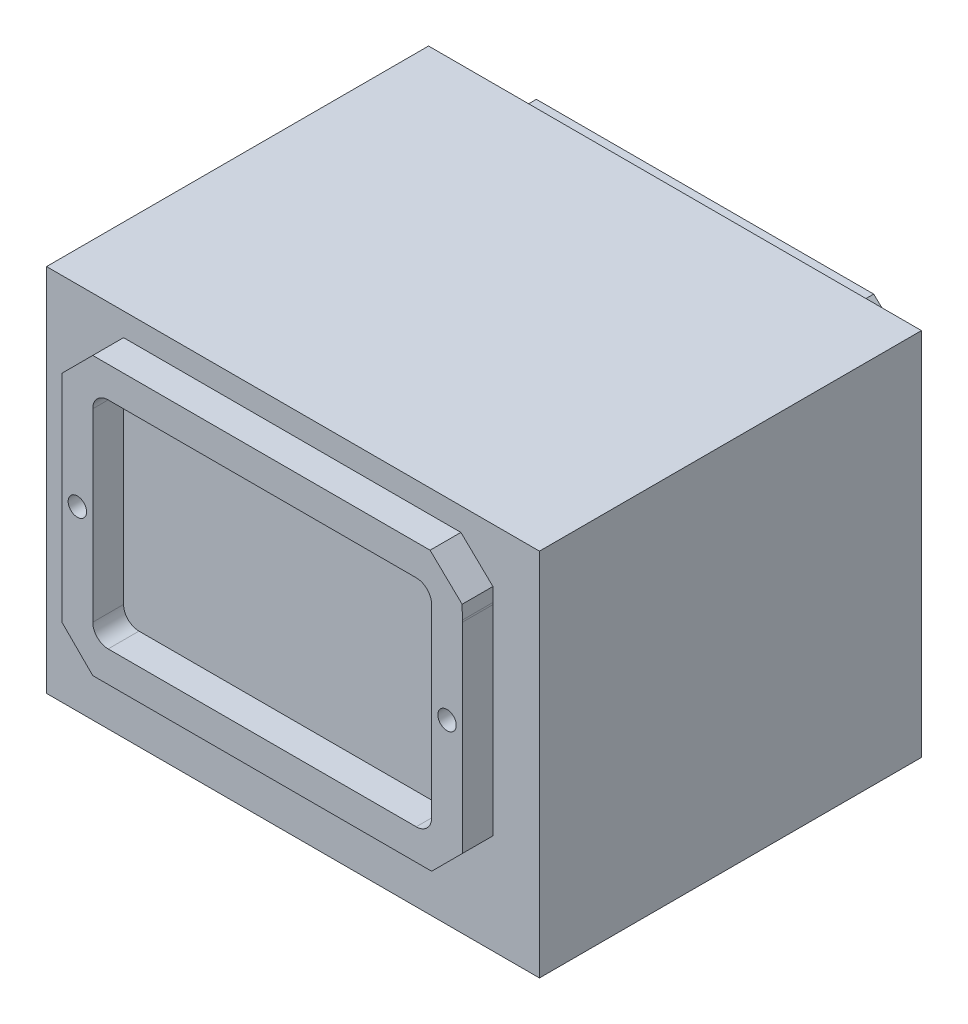
from build123d import *
from OCP.BRepFilletAPI import BRepFilletAPI_MakeChamfer

# Parameters (mm, degrees)
SKETCH1_W                        = 101.6
SKETCH1_H                        = 76.2
EXTRUDE1_DEPTH                   = 76.2
EXTRUDE2_DEPTH                   = 6.35
F_10_24_TAPPED_HOLE1_D           = 3.7973
F_10_24_TAPPED_HOLE1_DEPTH       = 12.954
F_10_24_TAPPED_HOLE1_TIP         = 1.140824014
EXTRUDE3_DEPTH                   = 6.35
CHAMFER1_SIZE                    = 6.35
CHAMFER1_SIZE2                   = 6.479869459
EXTRUDE4_DEPTH                   = 6.35
SKETCH8_W                        = 101.6
SKETCH8_H                        = 76.2
EXTRUDE5_DEPTH                   = 2.54
F_10_24_TAPPED_HOLE2_D           = 3.7973
F_10_24_TAPPED_HOLE2_DEPTH       = 12.954
F_10_24_TAPPED_HOLE2_CBORE_D     = 4.826
F_10_24_TAPPED_HOLE2_CBORE_DEPTH = 9.652
F_10_24_TAPPED_HOLE2_TIP         = 1.140824014


with BuildPart() as part:
    # Sketch1 → Extrude1 (new body)
    with BuildSketch(Plane(origin=(0, 0, 0), x_dir=(1, 0, 0), z_dir=(0, 1, 0))):
        with Locations((50.8, 38.1)):
            Rectangle(SKETCH1_W, SKETCH1_H)
    extrude(amount=-EXTRUDE1_DEPTH)

    # Sketch3 → Extrude2 (add)
    with BuildSketch(Plane.XY):
        with BuildLine():
            Line((19.05, -4.754440133), (82.55, -4.754440133))
            ThreePointArc((82.55, -4.754440133), (89.285192091, -7.544248042), (92.075, -14.279440133))
            Line((92.075, -14.279440133), (92.075, -52.379440133))
            ThreePointArc((92.075, -52.379440133), (89.285192091, -59.114632223), (82.55, -61.904440133))
            Line((82.55, -61.904440133), (19.05, -61.904440133))
            ThreePointArc((19.05, -61.904440133), (12.314807909, -59.114632223), (9.525, -52.379440133))
            Line((9.525, -52.379440133), (9.525, -14.279440133))
            ThreePointArc((9.525, -14.279440133), (12.314807909, -7.544248042), (19.05, -4.754440133))
        make_face()
        with BuildLine():
            Line((19.05, -11.104440133), (82.55, -11.104440133))
            ThreePointArc((82.55, -11.104440133), (84.79506403, -12.034376102), (85.725, -14.279440133))
            Line((85.725, -14.279440133), (85.725, -52.379440133))
            ThreePointArc((85.725, -52.379440133), (84.79506403, -54.624504163), (82.55, -55.554440133))
            Line((82.55, -55.554440133), (19.05, -55.554440133))
            ThreePointArc((19.05, -55.554440133), (16.80493597, -54.624504163), (15.875, -52.379440133))
            Line((15.875, -52.379440133), (15.875, -14.279440133))
            ThreePointArc((15.875, -14.279440133), (16.80493597, -12.034376102), (19.05, -11.104440133))
        make_face(mode=Mode.SUBTRACT)
    extrude(amount=EXTRUDE2_DEPTH)

    # #10-24 Tapped Hole1
    with Locations(Plane(origin=(12.7, -33.329440133, 6.35), x_dir=(1, 0, 0), z_dir=(0, 0, 1))):
        with Locations((0, 0), (76.2, 0)):
            Hole(F_10_24_TAPPED_HOLE1_D / 2, depth=F_10_24_TAPPED_HOLE1_DEPTH)
            with Locations((0, 0, -(F_10_24_TAPPED_HOLE1_DEPTH + F_10_24_TAPPED_HOLE1_TIP / 2))):  # 118° drill point
                Cone(0, F_10_24_TAPPED_HOLE1_D / 2, F_10_24_TAPPED_HOLE1_TIP, mode=Mode.SUBTRACT)

    # Sketch6 → Extrude3 (add)
    with BuildSketch(Plane.XY):
        Polygon((82.55, -4.754440133), (91.885938624, -4.754440133), (92.075, -14.279440133), align=None)
        Polygon((92.075, -52.379440133), (82.55, -61.904440133), (92.075, -61.904440133), align=None)
        Polygon((9.525, -14.279440133), (19.05, -4.754440133), (9.525, -4.754440133), align=None)
        Polygon((9.525, -52.379440133), (19.05, -61.904440133), (9.525, -61.904440133), align=None)
    extrude(amount=EXTRUDE3_DEPTH)

    # Chamfer1: one chamfer whose edges measure the first distance from different faces: ONE call of the kernel's chamfer builder (chamfer() names one face for all edges)
    chamfer1_edges_1 = [part.edges().sort_by_distance(p)[0] for p in [
        (92.075, -61.904440133, 3.175),
        (9.525, -61.904440133, 3.175),
        (9.525, -4.754440133, 3.175),
    ]]
    chamfer1_edges_2 = [part.edges().sort_by_distance(p)[0] for p in [
        (91.885938624, -4.754440133, 3.175),
    ]]
    chamfer1_side_2 = [part.faces().sort_by_distance(p)[0] for p in [
        (91.976718118, -9.327953214, 3.175),
    ]]
    chamfer1 = BRepFilletAPI_MakeChamfer(part.part.solid().wrapped)
    for e in chamfer1_edges_1:
        chamfer1.Add(CHAMFER1_SIZE, e.wrapped)
    for e in chamfer1_edges_2:
        chamfer1.Add(CHAMFER1_SIZE, CHAMFER1_SIZE2, e.wrapped, chamfer1_side_2[0].wrapped)  # the first distance lies on this face
    add(Compound.cast(chamfer1.Shape()), mode=Mode.REPLACE)



with BuildPart() as body_2:
    # Sketch7 → Extrude4 (new body)
    with BuildSketch(Plane(origin=(0, 0, -78.74), x_dir=(-1, 0, 0), z_dir=(0, 0, -1))):
        Polygon((-85.406069165, -4.754440133), (-15.875, -4.754440133), (-9.525, -11.104440133), (-9.525, -55.554440133), (-15.875, -61.904440133), (-85.725, -61.904440133), (-92.075, -55.554440133), (-92.075, -11.103141464), align=None)
        with BuildLine():
            Line((-15.875, -14.406440133), (-15.875, -52.252440133))
            ThreePointArc((-15.875, -52.252440133), (-16.842133409, -54.587306724), (-19.177, -55.554440133))
            Line((-19.177, -55.554440133), (-82.423, -55.554440133))
            ThreePointArc((-82.423, -55.554440133), (-84.757866591, -54.587306724), (-85.725, -52.252440133))
            Line((-85.725, -52.252440133), (-85.725, -14.406440133))
            ThreePointArc((-85.725, -14.406440133), (-84.757866591, -12.071573541), (-82.423, -11.104440133))
            Line((-82.423, -11.104440133), (-19.177, -11.104440133))
            ThreePointArc((-19.177, -11.104440133), (-16.842133409, -12.071573541), (-15.875, -14.406440133))
        make_face(mode=Mode.SUBTRACT)
    extrude(amount=EXTRUDE4_DEPTH)


with BuildPart() as part_1:
    add(part.part)

    add(body_2.part)  # Extrude5 merges body 2
    # Sketch8 → Extrude5 (add)
    with BuildSketch(Plane(origin=(0, 0, -76.2), x_dir=(-1, 0, 0), z_dir=(0, 0, -1))):
        with Locations((-50.8, -38.1)):
            Rectangle(SKETCH8_W, SKETCH8_H)
    extrude(amount=EXTRUDE5_DEPTH)

    # #10-24 Tapped Hole2
    with Locations(Plane(origin=(88.9, -33.329440133, -85.09), x_dir=(-1, 0, 0), z_dir=(0, 0, -1))):
        with Locations((0, 0), (76.2, 0)):
            CounterBoreHole(F_10_24_TAPPED_HOLE2_D / 2, F_10_24_TAPPED_HOLE2_CBORE_D / 2, F_10_24_TAPPED_HOLE2_CBORE_DEPTH, depth=F_10_24_TAPPED_HOLE2_DEPTH)
            with Locations((0, 0, -(F_10_24_TAPPED_HOLE2_DEPTH + F_10_24_TAPPED_HOLE2_TIP / 2))):  # 118° drill point
                Cone(0, F_10_24_TAPPED_HOLE2_D / 2, F_10_24_TAPPED_HOLE2_TIP, mode=Mode.SUBTRACT)


solid = part_1.part
